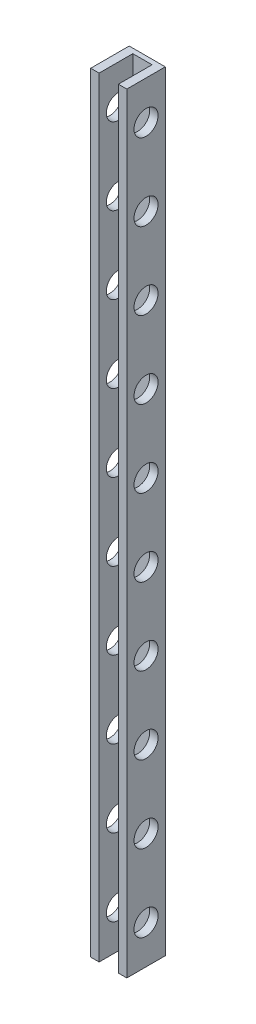
from build123d import *

# Parameters (mm, degrees)
BASE_DEPTH  = 160
ESQUISSE2_R = 2.5
TROU_DEPTH  = 161.225622171


with BuildPart() as part:
    # Esquisse1 → Base (new body)
    with BuildSketch(Plane(origin=(0, 0, 0), x_dir=(1, 0, 0), z_dir=(0, 1, 0))):
        Polygon((-2, -4), (-2, 3), (2, 3), (2, -4), (3.75, -4), (3.75, 4), (-3.75, 4), (-3.75, -4), align=None)
    extrude(amount=-BASE_DEPTH)

    # Esquisse2 → Trou (cut, through all)
    with BuildSketch(Plane.ZY.offset(3.75)):
        with Locations((0, -8)):
            Circle(ESQUISSE2_R)
        with Locations((0, -24)):
            Circle(ESQUISSE2_R)
        with Locations((0, -40)):
            Circle(ESQUISSE2_R)
        with Locations((0, -56)):
            Circle(ESQUISSE2_R)
        with Locations((0, -72)):
            Circle(ESQUISSE2_R)
        with Locations((0, -88)):
            Circle(ESQUISSE2_R)
        with Locations((0, -104)):
            Circle(ESQUISSE2_R)
        with Locations((0, -120)):
            Circle(ESQUISSE2_R)
        with Locations((0, -136)):
            Circle(ESQUISSE2_R)
        with Locations((0, -152)):
            Circle(ESQUISSE2_R)
    extrude(amount=-TROU_DEPTH, mode=Mode.SUBTRACT)


solid = part.part
